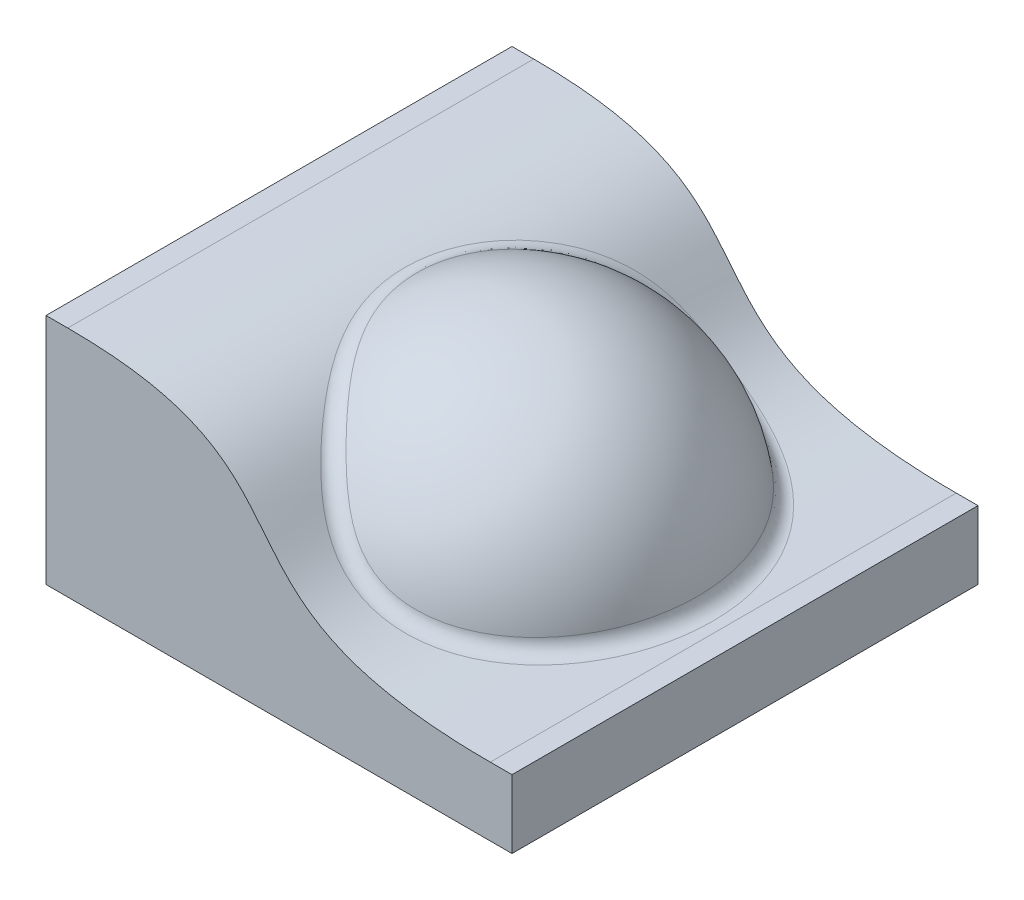
from build123d import *

# Parameters (mm, degrees)
EXTRUDE1_DEPTH      = 75
EXTRUDE1_DEPTH_BACK = 75
FILLET2_R           = 5


with BuildPart() as part:
    # Sketch1 → Extrude1 (new, two sides: drawn at the far end of the back side and taken through both)
    with BuildSketch(Plane.XY.offset(-EXTRUDE1_DEPTH_BACK)):
        with BuildLine():
            Line((68, -58), (75, -58))
            Line((75, -58), (75, -80))
            Line((75, -80), (-75, -80))
            Line((-75, -80), (-75, -5))
            Line((-75, -5), (-68, -5))
            add(Edge.make_bspline(
                [(-68, -5), (19.719434236, -5), (-30.32506556, -58), (68, -58)],
                knots=[0, 0, 0, 0, 1, 1, 1, 1], degree=3))
        make_face()
    extrude(amount=EXTRUDE1_DEPTH + EXTRUDE1_DEPTH_BACK)

    # Sketch2 → Revolve1 (revolve)
    with BuildSketch(Plane.XY):
        with BuildLine():
            Line((0, -60), (60, -60))
            ThreePointArc((60, -60), (42.426406871, -17.573593129), (0, 0))
            Line((0, 0), (0, -60))
        make_face()
    revolve(axis=Axis((0, 11.185160428, 0), (0, -1, 0)))

    # Fillet2
    fillet2_edges = [part.edges().sort_by_distance(p)[0] for p in [
        (9.137379972, -44.707678169, -57.294442834),
    ]]
    fillet(fillet2_edges, radius=FILLET2_R)


solid = part.part
